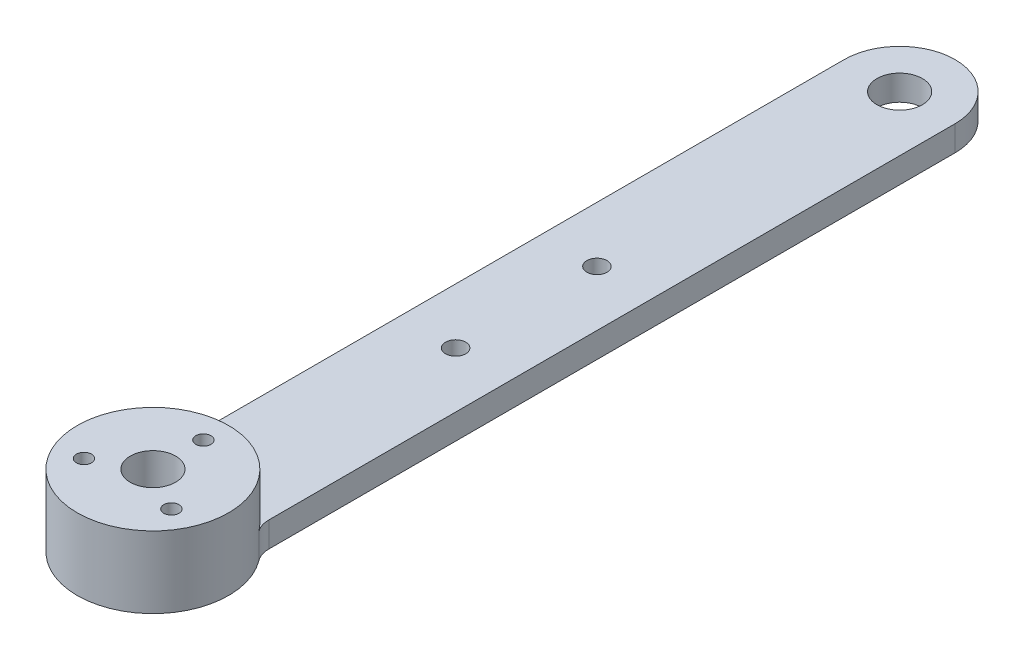
from build123d import *

# Parameters (mm, degrees)
SKETCH_1_R      = 4.5
SKETCH_1_R_2    = 2
SKETCH_1_R_3    = 1.5
EXTRUDE_1_DEPTH = 5
SKETCH_2_R      = 15
SKETCH_2_R_2    = 1.5
SKETCH_2_R_3    = 4.5
EXTRUDE_3_DEPTH = 9.2


with BuildPart() as part:
    # 草图1 → 凸台-拉伸1 (new body)
    with BuildSketch(Plane(origin=(0, 0, 0), x_dir=(1, 0, 0), z_dir=(0, 1, 0))):
        with BuildLine():
            Line((-67.537117904, 79.170305677), (-67.537117904, -56.829694323))
            ThreePointArc((-67.537117904, -56.829694323), (-67.793701414, -58.410833153), (-68.537117904, -59.829694323))
            ThreePointArc((-68.537117904, -59.829694323), (-56.537117904, -83.829694323), (-44.537117904, -59.829694323))
            ThreePointArc((-44.537117904, -59.829694323), (-45.280534394, -58.410833153), (-45.537117904, -56.829694323))
            Line((-45.537117904, -56.829694323), (-45.537117904, 79.170305677))
            ThreePointArc((-45.537117904, 79.170305677), (-56.537117904, 90.170305677), (-67.537117904, 79.170305677))
        make_face()
        with Locations(Location((-56.537117904, 79.170305677, 0), (0, 0, 270))):
            Circle(SKETCH_1_R, mode=Mode.SUBTRACT)
        with Locations(Location((-56.537117904, 19.170305677, 0), (0, 0, 270))):
            Circle(SKETCH_1_R_2, mode=Mode.SUBTRACT)
        with Locations(Location((-56.537117904, -8.829694323, 0), (0, 0, 270))):
            Circle(SKETCH_1_R_2, mode=Mode.SUBTRACT)
        with Locations(Location((-56.537117904, -68.829694323, 0), (0, 0, 270))):
            Circle(SKETCH_1_R, mode=Mode.SUBTRACT)
        with Locations(Location((-65.197371942, -73.829694323, 0), (0, 0, 270))):
            Circle(SKETCH_1_R_3, mode=Mode.SUBTRACT)
        with Locations(Location((-47.876863866, -73.829694323, 0), (0, 0, 270))):
            Circle(SKETCH_1_R_3, mode=Mode.SUBTRACT)
        with Locations(Location((-56.537117904, -58.829694323, 0), (0, 0, 270))):
            Circle(SKETCH_1_R_3, mode=Mode.SUBTRACT)
    extrude(amount=EXTRUDE_1_DEPTH)

    # 草图2 → 凸台-拉伸3 (add)
    with BuildSketch(Plane(origin=(0, 5, 0), x_dir=(1, 0, 0), z_dir=(0, 1, 0))):
        with Locations(Location((-56.537117904, -68.829694323, 0), (0, 0, 36.869897646))):
            Circle(SKETCH_2_R)
        with Locations(Location((-65.197371942, -73.829694323, 0), (0, 0, 270))):
            Circle(SKETCH_2_R_2, mode=Mode.SUBTRACT)
        with Locations(Location((-56.537117904, -58.829694323, 0), (0, 0, 270))):
            Circle(SKETCH_2_R_2, mode=Mode.SUBTRACT)
        with Locations(Location((-47.876863866, -73.829694323, 0), (0, 0, 270))):
            Circle(SKETCH_2_R_2, mode=Mode.SUBTRACT)
        with Locations(Location((-56.537117904, -68.829694323, 0), (0, 0, 270))):
            Circle(SKETCH_2_R_3, mode=Mode.SUBTRACT)
    extrude(amount=EXTRUDE_3_DEPTH)


solid = part.part
